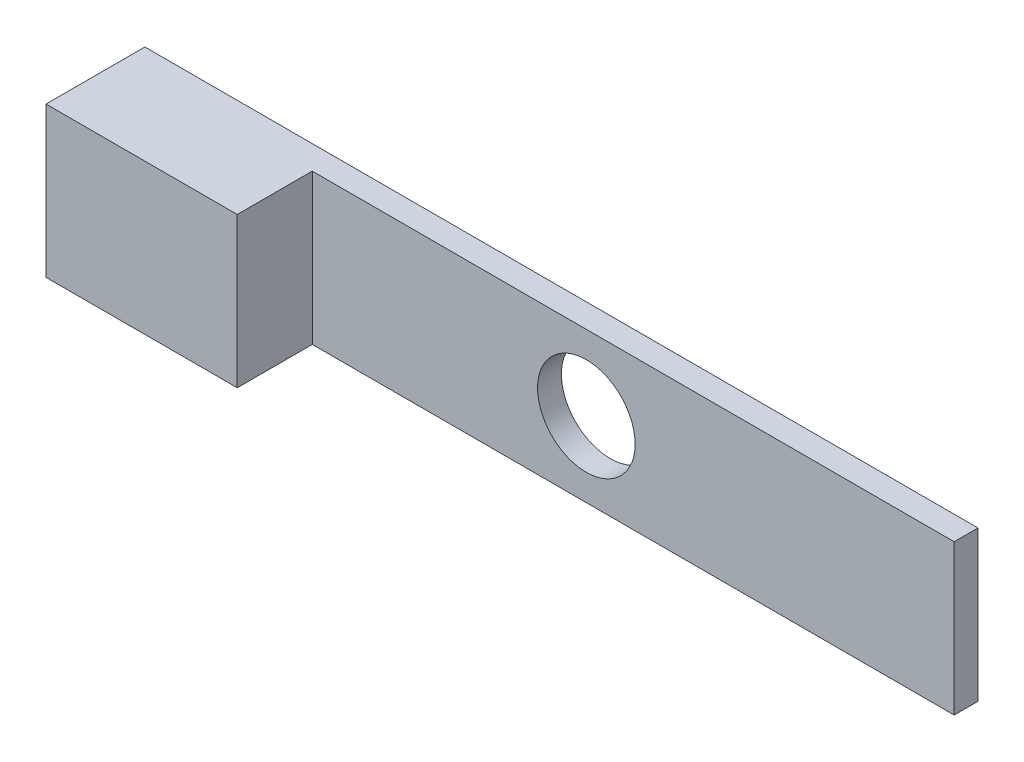
from build123d import *

# Parameters (mm, degrees)
SKETCH1_W               = 111.013561953
SKETCH1_H               = 10
BOSS_EXTRUDE3_DEPTH     = 1.5875
CUT_EXTRUDE1_DEPTH      = 114.026682648
CUT_EXTRUDE1_DEPTH_BACK = 114.026682648
SKETCH2_R               = 6.5
SKETCH3_W               = 25.483030165
SKETCH3_H               = 20
BOSS_EXTRUDE4_DEPTH     = 10


with BuildPart() as part:
    # Sketch1 → Boss-Extrude3 (new, symmetric)
    with BuildSketch(Plane.XY):
        with Locations((-57.031880671, 5)):
            Rectangle(SKETCH1_W, SKETCH1_H)
        with Locations((-57.031880671, -5)):
            Rectangle(SKETCH1_W, SKETCH1_H)
    extrude(amount=BOSS_EXTRUDE3_DEPTH, both=True)

    # Sketch2 → Cut-Extrude1 (cut, two sides: drawn at the far end of the back side and taken through both)
    with BuildSketch(Plane.XY.offset(1.5875).offset(-CUT_EXTRUDE1_DEPTH_BACK)):
        with Locations((-50.538661647, 0)):
            Circle(SKETCH2_R)
    extrude(amount=CUT_EXTRUDE1_DEPTH + CUT_EXTRUDE1_DEPTH_BACK, mode=Mode.SUBTRACT)

    # Sketch3 → Boss-Extrude4 (add)
    with BuildSketch(Plane.XY.offset(1.5875)):
        with Locations((-99.797146565, 0)):
            Rectangle(SKETCH3_W, SKETCH3_H)
    extrude(amount=BOSS_EXTRUDE4_DEPTH)


solid = part.part
